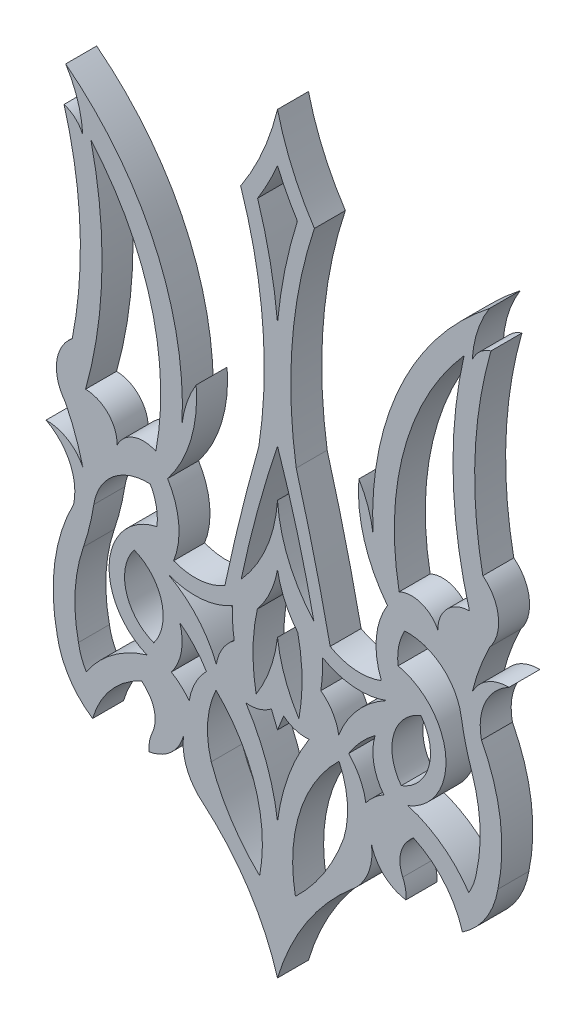
from build123d import *

# Parameters (mm, degrees)
EXTRUDE_1_DEPTH     = 10
CUT_EXTRUDE_4_DEPTH = 10


with BuildPart() as part:
    # Эскиз3 → Бобышка-Вытянуть1 (new body)
    with BuildSketch(Plane.XY):
        with BuildLine():
            ThreePointArc((75.737298173, 214.827117189), (82.873597213, 227.992034462), (87.644341315, 242.186463353))
            ThreePointArc((87.644341315, 242.186463353), (92.415085417, 227.992034462), (99.551384458, 214.827117189))
            ThreePointArc((99.551384458, 214.827117189), (92.448615199, 180.200274987), (93.683201055, 144.874033612))
            ThreePointArc((93.683201055, 144.874033612), (99.543941176, 122.77181273), (104.650975019, 100.483370703))
            ThreePointArc((104.650975019, 100.483370703), (112.761124808, 97.943619496), (121.169223706, 99.180041243))
            ThreePointArc((121.169223706, 99.180041243), (119.549894236, 110.406048742), (123.14170404, 121.164504703))
            ThreePointArc((123.14170404, 121.164504703), (115.644359384, 135.701433483), (113.915816321, 151.966261))
            ThreePointArc((113.915816321, 151.966261), (116.901405678, 145.64272451), (118.481996173, 138.830779763))
            ThreePointArc((118.481996173, 138.830779763), (127.24668609, 184.362661976), (156.055436754, 220.69485118))
            ThreePointArc((156.055436754, 220.69485118), (152.204137163, 212.503983736), (150.529344239, 203.609160148))
            ThreePointArc((150.529344239, 203.609160148), (152.949885488, 207.021489641), (156.580265974, 209.100756347))
            ThreePointArc((156.580265974, 209.100756347), (151.4198282, 177.15256964), (153.948768597, 144.889259016))
            ThreePointArc((153.948768597, 144.889259016), (158.962764238, 135.949313763), (156.186698644, 126.082387532))
            ThreePointArc((156.186698644, 126.082387532), (152.918092332, 118.533010155), (150.508133779, 110.667326092))
            ThreePointArc((150.508133779, 110.667326092), (155.402709379, 116.006658411), (162.390479703, 117.913594648))
            ThreePointArc((162.390479703, 117.913594648), (154.707516768, 109.824907217), (153.507722785, 98.733681937))
            ThreePointArc((153.507722785, 98.733681937), (159.570043449, 79.653195004), (158.80328853, 59.647475814))
            ThreePointArc((158.80328853, 59.647475814), (154.917566842, 49.613113406), (147.358546899, 41.95488388))
            ThreePointArc((147.358546899, 41.95488388), (141.45972495, 52.906488134), (131.532504975, 60.402089491))
            ThreePointArc((131.532504975, 60.402089491), (130.313453485, 59.224360677), (129.217982636, 57.930886552))
            ThreePointArc((129.217982636, 57.930886552), (127.222488275, 52.953447096), (128.085354098, 47.660776328))
            ThreePointArc((128.085354098, 47.660776328), (128.974997774, 44.792014096), (129.083146931, 41.790420124))
            ThreePointArc((129.083146931, 41.790420124), (122.02961795, 45.187826335), (117.983840441, 51.890536563))
            ThreePointArc((117.983840441, 51.890536563), (116.942345618, 43.244180813), (111.79351299, 36.220385415))
            ThreePointArc((111.79351299, 36.220385415), (97.034028223, 19.487966284), (87.644341315, -0.751846469))
            ThreePointArc((87.644341315, -0.751846469), (78.254654407, 19.487966284), (63.495169641, 36.220385415))
            ThreePointArc((63.495169641, 36.220385415), (58.346337012, 43.244180813), (57.30484219, 51.890536563))
            ThreePointArc((57.30484219, 51.890536563), (53.25906468, 45.187826335), (46.205535699, 41.790420124))
            ThreePointArc((46.205535699, 41.790420124), (46.313684857, 44.792014096), (47.203328533, 47.660776328))
            ThreePointArc((47.203328533, 47.660776328), (48.066194355, 52.953447096), (46.070699995, 57.930886552))
            ThreePointArc((46.070699995, 57.930886552), (44.975229145, 59.224360677), (43.756177656, 60.402089491))
            ThreePointArc((43.756177656, 60.402089491), (33.828957681, 52.906488134), (27.930135731, 41.95488388))
            ThreePointArc((27.930135731, 41.95488388), (20.371115788, 49.613113406), (16.4853941, 59.647475814))
            ThreePointArc((16.4853941, 59.647475814), (15.718639182, 79.653195004), (21.780959845, 98.733681937))
            ThreePointArc((21.780959845, 98.733681937), (20.581165862, 109.824907217), (12.898202928, 117.913594648))
            ThreePointArc((12.898202928, 117.913594648), (19.885973252, 116.006658411), (24.780548852, 110.667326092))
            ThreePointArc((24.780548852, 110.667326092), (22.370590299, 118.533010155), (19.101983986, 126.082387532))
            ThreePointArc((19.101983986, 126.082387532), (16.325918393, 135.949313763), (21.339914033, 144.889259016))
            ThreePointArc((21.339914033, 144.889259016), (23.868854431, 177.15256964), (18.708416657, 209.100756347))
            ThreePointArc((18.708416657, 209.100756347), (22.338797143, 207.021489641), (24.759338391, 203.609160148))
            ThreePointArc((24.759338391, 203.609160148), (23.084545467, 212.503983736), (19.233245877, 220.69485118))
            ThreePointArc((19.233245877, 220.69485118), (48.041996541, 184.362661976), (56.806686458, 138.830779763))
            ThreePointArc((56.806686458, 138.830779763), (58.387276952, 145.64272451), (61.37286631, 151.966261))
            ThreePointArc((61.37286631, 151.966261), (59.644323247, 135.701433483), (52.14697859, 121.164504703))
            ThreePointArc((52.14697859, 121.164504703), (55.738788395, 110.406048742), (54.119458925, 99.180041243))
            ThreePointArc((54.119458925, 99.180041243), (62.527557822, 97.943619496), (70.637707612, 100.483370703))
            ThreePointArc((70.637707612, 100.483370703), (75.744741455, 122.77181273), (81.605481576, 144.874033612))
            ThreePointArc((81.605481576, 144.874033612), (82.840067432, 180.200274987), (75.737298173, 214.827117189))
        make_face()
    extrude(amount=EXTRUDE_1_DEPTH)

    # Эскиз4 → Вырез-Вытянуть4 (cut)
    with BuildSketch(Plane.XY):
        with BuildLine():
            Line((85.654622356, 73.518555252), (87.644341315, 68.631836287))
            Line((87.644341315, 68.631836287), (89.634060275, 73.518555252))
            ThreePointArc((89.634060275, 73.518555252), (93.498316524, 71.48652915), (97.84617103, 71.089329421))
            ThreePointArc((97.84617103, 71.089329421), (91.177891627, 57.600515287), (87.644341315, 42.974234859))
            ThreePointArc((87.644341315, 42.974234859), (84.110791004, 57.600515287), (77.442511601, 71.089329421))
            ThreePointArc((77.442511601, 71.089329421), (81.790366107, 71.48652915), (85.654622356, 73.518555252))
        make_face()
        with BuildLine():
            ThreePointArc((87.644341315, 148.003447902), (81.149794041, 126.61690118), (75.910198282, 104.888805053))
            ThreePointArc((75.910198282, 104.888805053), (84.118417763, 117.892428675), (87.644341315, 132.860292833))
            ThreePointArc((87.644341315, 132.860292833), (91.170264867, 117.892428675), (99.378484349, 104.888805053))
            ThreePointArc((99.378484349, 104.888805053), (94.138888589, 126.61690118), (87.644341315, 148.003447902))
        make_face()
        with BuildLine():
            ThreePointArc((67.78082661, 69.825446008), (80.476833117, 49.16569034), (81.871403931, 24.956823002))
            ThreePointArc((81.871403931, 24.956823002), (72.654345055, 36.068206288), (66.24306766, 49.003140961))
            ThreePointArc((66.24306766, 49.003140961), (65.085086418, 59.556595084), (67.78082661, 69.825446008))
        make_face()
        with BuildLine():
            ThreePointArc((64.682165911, 73.518555252), (60.834261147, 78.585776038), (56.108384596, 82.845962464))
            ThreePointArc((56.108384596, 82.845962464), (56.577504562, 74.908677344), (53.334779442, 67.648835581))
            ThreePointArc((53.334779442, 67.648835581), (56.48094396, 65.35561463), (59.118823877, 62.492259422))
            ThreePointArc((59.118823877, 62.492259422), (61.041725308, 68.438701437), (64.682165911, 73.518555252))
        make_face()
        with BuildLine():
            ThreePointArc((67.908044121, 77.068549767), (61.672372831, 87.192623316), (52.307890576, 94.519760123))
            ThreePointArc((52.307890576, 94.519760123), (62.92084749, 92.959111172), (73.157724023, 96.164862015))
            ThreePointArc((73.157724023, 96.164862015), (73.141858231, 91.35681801), (73.672035417, 86.578068066))
            ThreePointArc((73.672035417, 86.578068066), (69.829998601, 82.405217354), (67.908044121, 77.068549767))
        make_face()
        with BuildLine():
            ThreePointArc((41.355166098, 95.816406993), (50.176134503, 85.986630032), (47.690712162, 73.01525098))
            ThreePointArc((47.690712162, 73.01525098), (38.779973269, 82.820084247), (41.355166098, 95.816406993))
        make_face()
        with BuildLine():
            ThreePointArc((87.644341315, 113.482689605), (85.301833907, 105.901746444), (81.11356181, 99.162576093))
            ThreePointArc((81.11356181, 99.162576093), (79.725329835, 87.19291901), (80.737859658, 75.18564363))
            ThreePointArc((80.737859658, 75.18564363), (85.275242606, 84.465427513), (87.644341315, 94.519760123))
            ThreePointArc((87.644341315, 94.519760123), (90.013440024, 84.465427513), (94.550822973, 75.18564363))
            ThreePointArc((94.550822973, 75.18564363), (95.563352796, 87.19291901), (94.17512082, 99.162576093))
            ThreePointArc((94.17512082, 99.162576093), (89.986848724, 105.901746444), (87.644341315, 113.482689605))
        make_face()
        with BuildLine():
            ThreePointArc((133.933516533, 95.816406993), (136.508709361, 82.820084247), (127.597970468, 73.01525098))
            ThreePointArc((127.597970468, 73.01525098), (125.112548128, 85.986630032), (133.933516533, 95.816406993))
        make_face()
        with BuildLine():
            ThreePointArc((101.616647213, 86.578068066), (102.1468244, 91.35681801), (102.130958608, 96.164862015))
            ThreePointArc((102.130958608, 96.164862015), (112.36783514, 92.959111172), (122.980792054, 94.519760123))
            ThreePointArc((122.980792054, 94.519760123), (113.6163098, 87.192623316), (107.38063851, 77.068549767))
            ThreePointArc((107.38063851, 77.068549767), (105.45868403, 82.405217354), (101.616647213, 86.578068066))
        make_face()
        with BuildLine():
            ThreePointArc((116.169858754, 62.492259422), (118.807738671, 65.35561463), (121.953903189, 67.648835581))
            ThreePointArc((121.953903189, 67.648835581), (118.711178069, 74.908677344), (119.180298034, 82.845962464))
            ThreePointArc((119.180298034, 82.845962464), (114.454421483, 78.585776038), (110.60651672, 73.518555252))
            ThreePointArc((110.60651672, 73.518555252), (114.246957322, 68.438701437), (116.169858754, 62.492259422))
        make_face()
        with BuildLine():
            ThreePointArc((109.045614971, 49.003140961), (110.203596213, 59.556595084), (107.507856021, 69.825446008))
            ThreePointArc((107.507856021, 69.825446008), (94.811849514, 49.16569034), (93.417278699, 24.956823002))
            ThreePointArc((93.417278699, 24.956823002), (102.634337575, 36.068206288), (109.045614971, 49.003140961))
        make_face()
        with BuildLine():
            ThreePointArc((46.570080759, 116.846320473), (34.595716893, 112.920248845), (28.316429178, 101.994592151))
            ThreePointArc((28.316429178, 101.994592151), (26.9333239, 95.142193412), (24.957292002, 88.436699647))
            ThreePointArc((24.957292002, 88.436699647), (22.277621632, 74.801992121), (23.365701976, 60.94912369))
            ThreePointArc((23.365701976, 60.94912369), (24.292977573, 57.352257012), (25.886565586, 53.996997383))
            ThreePointArc((25.886565586, 53.996997383), (34.413462447, 62.958528928), (45.462301972, 68.520917162))
            ThreePointArc((45.462301972, 68.520917162), (33.315609183, 88.459157063), (48.700428736, 106.019990853))
            ThreePointArc((48.700428736, 106.019990853), (48.506236595, 111.604542872), (46.570080759, 116.846320473))
        make_face()
        with BuildLine():
            ThreePointArc((151.922980655, 60.94912369), (150.995705058, 57.352257012), (149.402117045, 53.996997383))
            ThreePointArc((149.402117045, 53.996997383), (140.875220183, 62.958528928), (129.826380659, 68.520917162))
            ThreePointArc((129.826380659, 68.520917162), (141.973073448, 88.459157063), (126.588253895, 106.019990853))
            ThreePointArc((126.588253895, 106.019990853), (126.782446036, 111.604542872), (128.718601872, 116.846320473))
            ThreePointArc((128.718601872, 116.846320473), (140.692965737, 112.920248845), (146.972253453, 101.994592151))
            ThreePointArc((146.972253453, 101.994592151), (148.355358731, 95.142193412), (150.331390628, 88.436699647))
            ThreePointArc((150.331390628, 88.436699647), (153.011060999, 74.801992121), (151.922980655, 60.94912369))
        make_face()
        with BuildLine():
            ThreePointArc((48.355392718, 126.900367718), (46.714086351, 167.601052005), (27.386922462, 203.457715599))
            ThreePointArc((27.386922462, 203.457715599), (30.940238269, 168.082502681), (25.662297387, 132.923221086))
            ThreePointArc((25.662297387, 132.923221086), (32.940011964, 129.766489423), (35.853986928, 122.388221729))
            ThreePointArc((35.853986928, 122.388221729), (41.170193791, 127.233420637), (48.355392718, 126.900367718))
        make_face()
        with BuildLine():
            ThreePointArc((139.434695702, 122.388221729), (134.11848884, 127.233420637), (126.933289913, 126.900367718))
            ThreePointArc((126.933289913, 126.900367718), (128.57459628, 167.601052005), (147.901760168, 203.457715599))
            ThreePointArc((147.901760168, 203.457715599), (144.348444361, 168.082502681), (149.626385244, 132.923221086))
            ThreePointArc((149.626385244, 132.923221086), (142.348670666, 129.766489423), (139.434695702, 122.388221729))
        make_face()
        with BuildLine():
            ThreePointArc((94.066919651, 214.119894368), (90.031739471, 198.523177696), (87.644341315, 182.590802479))
            ThreePointArc((87.644341315, 182.590802479), (85.25694316, 198.523177696), (81.22176298, 214.119894368))
            ThreePointArc((81.22176298, 214.119894368), (84.665732339, 220.152220055), (87.644341315, 226.427390706))
            ThreePointArc((87.644341315, 226.427390706), (90.622950292, 220.152220055), (94.066919651, 214.119894368))
        make_face()
    extrude(amount=CUT_EXTRUDE_4_DEPTH, mode=Mode.SUBTRACT)


solid = part.part
